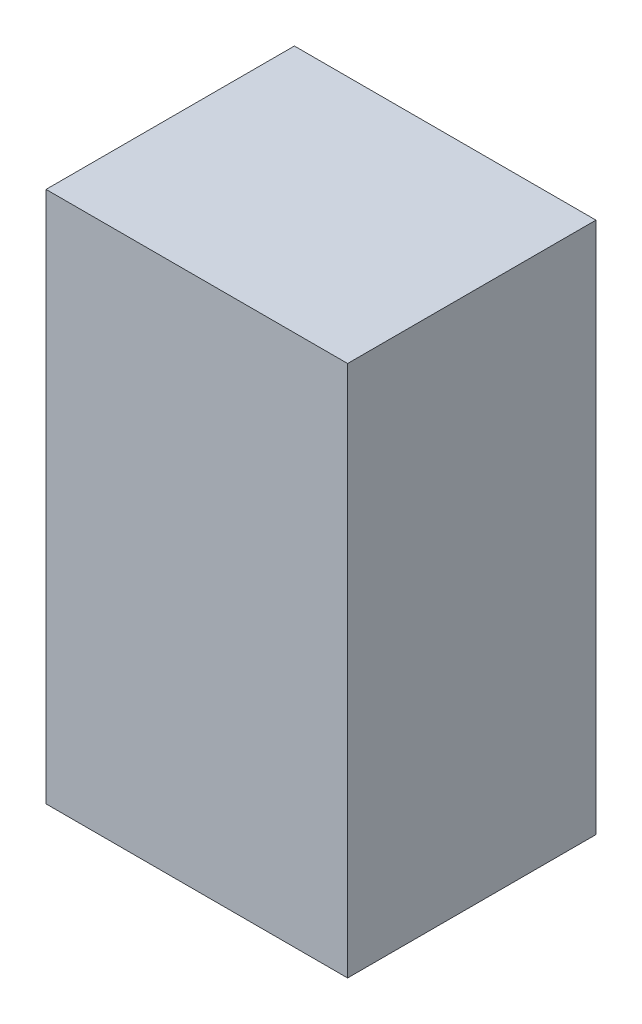
from build123d import *

# Parameters (mm, degrees)
SKETCH1_W               = 1.700022
SKETCH1_H               = 2.999994
COMPONENT_OUTLINE_DEPTH = 1.3999972


with BuildPart() as part:
    # Sketch1 → Component_Outline (new body)
    with BuildSketch(Plane.XY):
        Rectangle(SKETCH1_W, SKETCH1_H)
    extrude(amount=COMPONENT_OUTLINE_DEPTH)


solid = part.part
